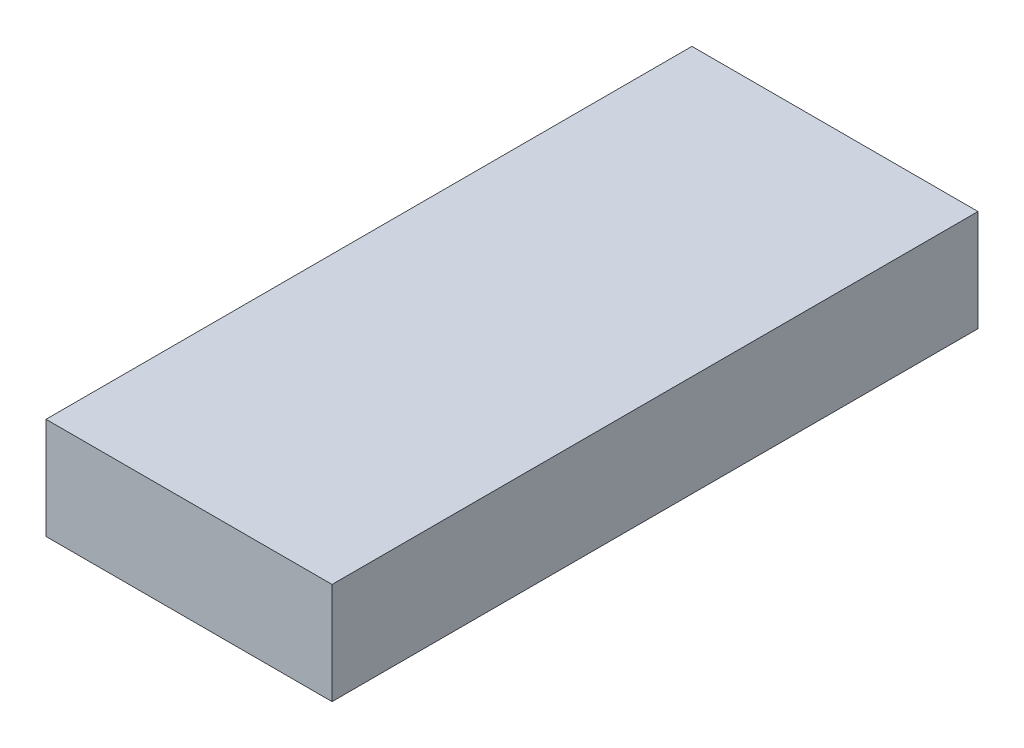
from build123d import *

# Parameters (mm, degrees)
SKETCH1_W           = 31
SKETCH1_H           = 11
BOSS_EXTRUDE1_DEPTH = 70


with BuildPart() as part:
    # Sketch1 → Boss-Extrude1 (new body)
    with BuildSketch(Plane.XY):
        with Locations((-15.5, 5.5)):
            Rectangle(SKETCH1_W, SKETCH1_H)
    extrude(amount=BOSS_EXTRUDE1_DEPTH)


solid = part.part
